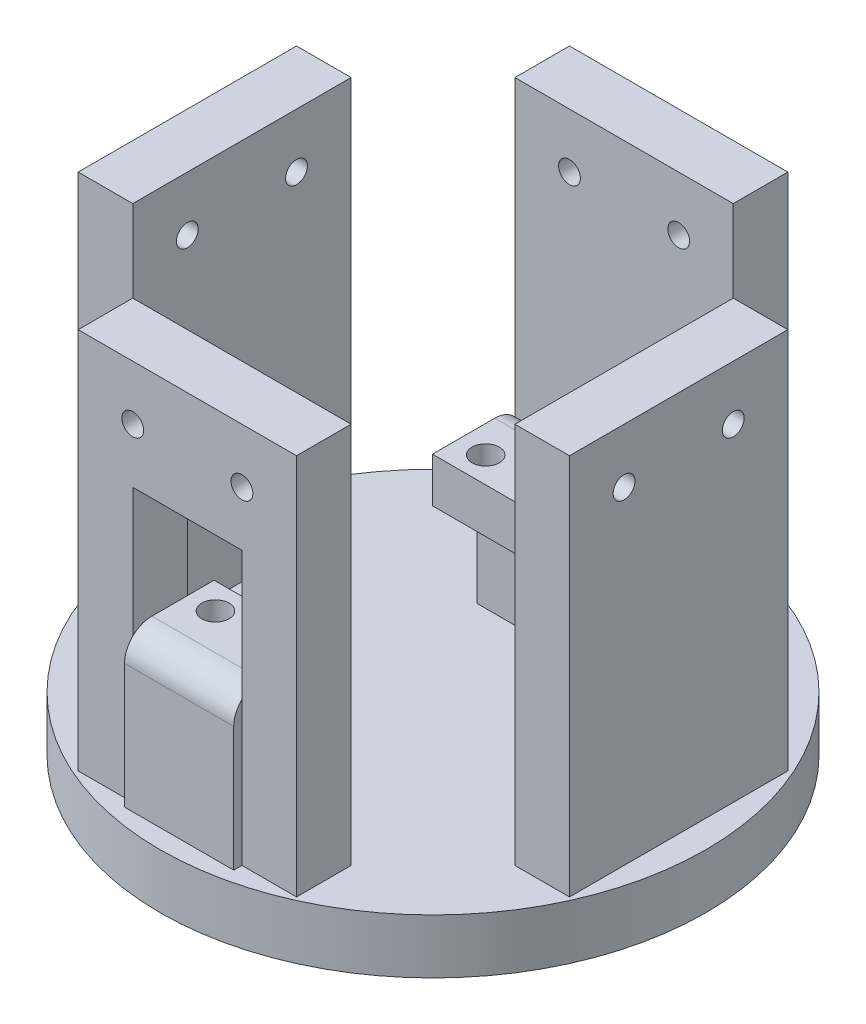
from build123d import *

# Parameters (mm, degrees)
SKETCH1_R                = 50
BOSS_EXTRUDE1_DEPTH      = 10
SKETCH2_W                = 20
SKETCH2_H                = 8.2
BOSS_EXTRUDE2_DEPTH      = 27.8
SKETCH3_W                = 20
SKETCH3_H                = 8.2
BOSS_EXTRUDE3_DEPTH      = 8.2
SKETCH4_W                = 20
SKETCH4_H                = 8.199243263
BOSS_EXTRUDE4_DEPTH      = 8.2
FILLET1_R                = 5
SKETCH7_R                = 2.5
CUT_EXTRUDE1_DEPTH       = 9
SKETCH5_W                = 10
SKETCH5_H                = 10
BOSS_EXTRUDE5_DEPTH      = 70
BOSS_EXTRUDE6_REACH      = 113.803
SKETCH8_W                = 10
SKETCH8_H                = 20
F_4_0_4_DIAMETER_HOLE1_D = 4
F_4_0_4_DIAMETER_HOLE2_D = 4
F_4_0_4_DIAMETER_HOLE3_D = 4


with BuildPart() as part:
    # Sketch1 → Boss-Extrude1 (new body)
    with BuildSketch(Plane(origin=(0, 0, 0), x_dir=(1, 0, 0), z_dir=(0, 1, 0))):
        with Locations(Location((0, 0, 0), (0, 0, 270))):
            Circle(SKETCH1_R)
    extrude(amount=BOSS_EXTRUDE1_DEPTH)

    # Sketch2 → Boss-Extrude2 (add)
    with BuildSketch(Plane(origin=(0, 10, 0), x_dir=(1, 0, 0), z_dir=(0, 1, 0))):
        with Locations((0, -42.4)):
            Rectangle(SKETCH2_W, SKETCH2_H)
        with Locations((0, 22.2)):
            Rectangle(SKETCH2_W, SKETCH2_H)
    extrude(amount=BOSS_EXTRUDE2_DEPTH)

    # Sketch3 → Boss-Extrude3 (add)
    with BuildSketch(Plane(origin=(0, 0, 38.3), x_dir=(-1, 0, 0), z_dir=(0, 0, -1))):
        with Locations((0, 33.7)):
            Rectangle(SKETCH3_W, SKETCH3_H)
    extrude(amount=BOSS_EXTRUDE3_DEPTH)

    # Sketch4 → Boss-Extrude4 (add)
    with BuildSketch(Plane.XY.offset(-18.1)):
        with Locations((0, 33.700378369)):
            Rectangle(SKETCH4_W, SKETCH4_H)
    extrude(amount=BOSS_EXTRUDE4_DEPTH)

    # Fillet1
    fillet1_edges = [part.edges().sort_by_distance(p)[0] for p in [
        (0, 37.8, -26.3),
        (0, 37.8, 46.5),
    ]]
    fillet(fillet1_edges, radius=FILLET1_R)

    # Sketch7 → Cut-Extrude1 (cut)
    with BuildSketch(Plane(origin=(0, 37.8, 0), x_dir=(1, 0, 0), z_dir=(0, 1, 0))):
        with Locations(Location((5, 14.65, 0), (0, 0, 270))):
            Circle(SKETCH7_R)
        with Locations(Location((-5, 14.65, 0), (0, 0, 270))):
            Circle(SKETCH7_R)
        with Locations(Location((-5, -34.85, 0), (0, 0, 270))):
            Circle(SKETCH7_R)
        with Locations(Location((5, -34.85, 0), (0, 0, 270))):
            Circle(SKETCH7_R)
    extrude(amount=-CUT_EXTRUDE1_DEPTH, mode=Mode.SUBTRACT)

    # Sketch5 → Boss-Extrude5 (add)
    with BuildSketch(Plane(origin=(0, 10, 0), x_dir=(1, 0, 0), z_dir=(0, 1, 0))):
        Polygon((35, 0), (35, 20), (45, 20), (45, -20), (35, -20), align=None)
        Polygon((-45, -20), (-35, -20), (-35, 0), (-35, 20), (-45, 20), align=None)
        with Locations((-15, -40)):
            Rectangle(SKETCH5_W, SKETCH5_H)
        with Locations((15, -40)):
            Rectangle(SKETCH5_W, SKETCH5_H)
        Polygon((-20, 35), (-20, 45), (20, 45), (20, 35), (0, 35), align=None)
    extrude(amount=BOSS_EXTRUDE5_DEPTH)

    # Sketch8 → Boss-Extrude6 (add, up to next)
    with BuildSketch(Plane.ZY.offset(-10), mode=Mode.PRIVATE) as boss_extrude6_sk1:
        with Locations((40, 70)):
            Rectangle(SKETCH8_W, SKETCH8_H)
    boss_extrude6_tool1 = extrude(boss_extrude6_sk1.sketch, amount=BOSS_EXTRUDE6_REACH, mode=Mode.PRIVATE) - part.part
    add(boss_extrude6_tool1.solids().sort_by_distance((10, 70, 40))[0])

    # Ø4.0 (4) Diameter Hole1 (through all)
    with Locations(Plane.XY.offset(45)):
        with Locations((-10, 70), (10, 70)):
            Hole(F_4_0_4_DIAMETER_HOLE1_D / 2)

    # Ø4.0 (4) Diameter Hole2 (through all)
    with Locations(Plane(origin=(45, 0, 0), x_dir=(0, 0, -1), z_dir=(1, 0, 0))):
        with Locations((-10, 70), (10, 70)):
            Hole(F_4_0_4_DIAMETER_HOLE2_D / 2)

    # Ø4.0 (4) Diameter Hole3 (through all)
    with Locations(Plane(origin=(0, 10, 0), x_dir=(1, 0, 0), z_dir=(0, 1, 0))):
        with Locations((-20, 0), (20, 0)):
            Hole(F_4_0_4_DIAMETER_HOLE3_D / 2)


solid = part.part
